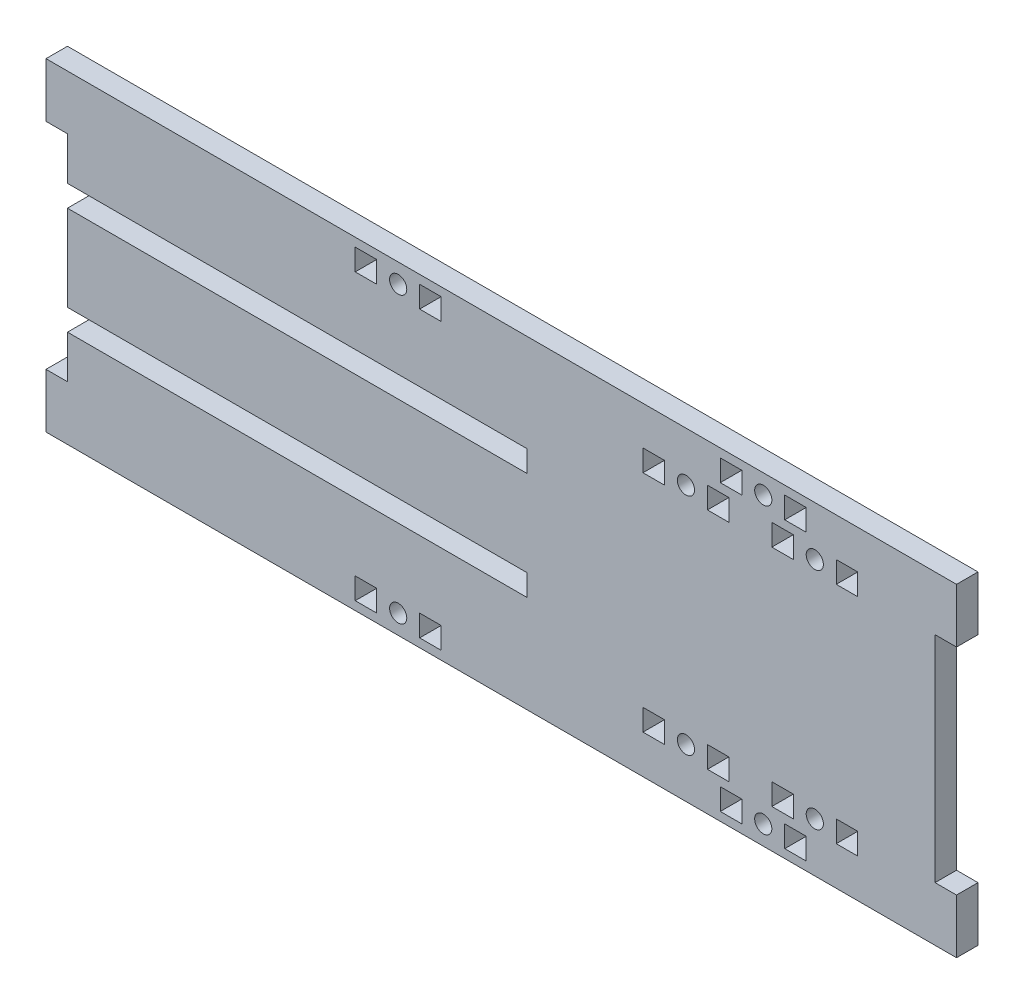
from build123d import *

# Parameters (mm, degrees)
ESQUISSE1_W        = 5
ESQUISSE1_H        = 5
ESQUISSE1_R        = 2
BOSS_EXTRU_1_DEPTH = 5


with BuildPart() as part:
    # Esquisse1 → Boss.-Extru.1 (new body)
    with BuildSketch(Plane.XY):
        Polygon((162, 37.65), (0, 37.65), (-50, 37.65), (-50, 25), (-45, 25), (-45, 15), (62, 15), (62, 10), (0, 10), (-45, 10), (-45, -10), (62, -10), (62, -15), (-45, -15), (-45, -25), (-50, -25), (-50, -37.65), (0, -37.65), (162, -37.65), (162, -25), (157, -25), (157, 25), (162, 25), align=None)
        with Locations((24.5, -33.15)):
            Rectangle(ESQUISSE1_W, ESQUISSE1_H, mode=Mode.SUBTRACT)
        with Locations((32, -33.15)):
            Circle(ESQUISSE1_R, mode=Mode.SUBTRACT)
        with Locations((39.5, -33.15)):
            Rectangle(ESQUISSE1_W, ESQUISSE1_H, mode=Mode.SUBTRACT)
        with Locations((91.5, -26.15)):
            Rectangle(ESQUISSE1_W, ESQUISSE1_H, mode=Mode.SUBTRACT)
        with Locations((99, -26.15)):
            Circle(ESQUISSE1_R, mode=Mode.SUBTRACT)
        with Locations((106.5, -26.15)):
            Rectangle(ESQUISSE1_W, ESQUISSE1_H, mode=Mode.SUBTRACT)
        with Locations((109.5, -33.15)):
            Rectangle(ESQUISSE1_W, ESQUISSE1_H, mode=Mode.SUBTRACT)
        with Locations((117, -33.15)):
            Circle(ESQUISSE1_R, mode=Mode.SUBTRACT)
        with Locations((124.5, -33.15)):
            Rectangle(ESQUISSE1_W, ESQUISSE1_H, mode=Mode.SUBTRACT)
        with Locations((121.5, -26.15)):
            Rectangle(ESQUISSE1_W, ESQUISSE1_H, mode=Mode.SUBTRACT)
        with Locations((129, -26.15)):
            Circle(ESQUISSE1_R, mode=Mode.SUBTRACT)
        with Locations((136.5, -26.15)):
            Rectangle(ESQUISSE1_W, ESQUISSE1_H, mode=Mode.SUBTRACT)
        with Locations((24.5, 33.15)):
            Rectangle(ESQUISSE1_W, ESQUISSE1_H, mode=Mode.SUBTRACT)
        with Locations((32, 33.15)):
            Circle(ESQUISSE1_R, mode=Mode.SUBTRACT)
        with Locations((39.5, 33.15)):
            Rectangle(ESQUISSE1_W, ESQUISSE1_H, mode=Mode.SUBTRACT)
        with Locations((91.5, 26.15)):
            Rectangle(ESQUISSE1_W, ESQUISSE1_H, mode=Mode.SUBTRACT)
        with Locations((99, 26.15)):
            Circle(ESQUISSE1_R, mode=Mode.SUBTRACT)
        with Locations((106.5, 26.15)):
            Rectangle(ESQUISSE1_W, ESQUISSE1_H, mode=Mode.SUBTRACT)
        with Locations((121.5, 26.15)):
            Rectangle(ESQUISSE1_W, ESQUISSE1_H, mode=Mode.SUBTRACT)
        with Locations((129, 26.15)):
            Circle(ESQUISSE1_R, mode=Mode.SUBTRACT)
        with Locations((136.5, 26.15)):
            Rectangle(ESQUISSE1_W, ESQUISSE1_H, mode=Mode.SUBTRACT)
        with Locations((109.5, 33.15)):
            Rectangle(ESQUISSE1_W, ESQUISSE1_H, mode=Mode.SUBTRACT)
        with Locations((117, 33.15)):
            Circle(ESQUISSE1_R, mode=Mode.SUBTRACT)
        with Locations((124.5, 33.15)):
            Rectangle(ESQUISSE1_W, ESQUISSE1_H, mode=Mode.SUBTRACT)
    extrude(amount=BOSS_EXTRU_1_DEPTH)


solid = part.part
